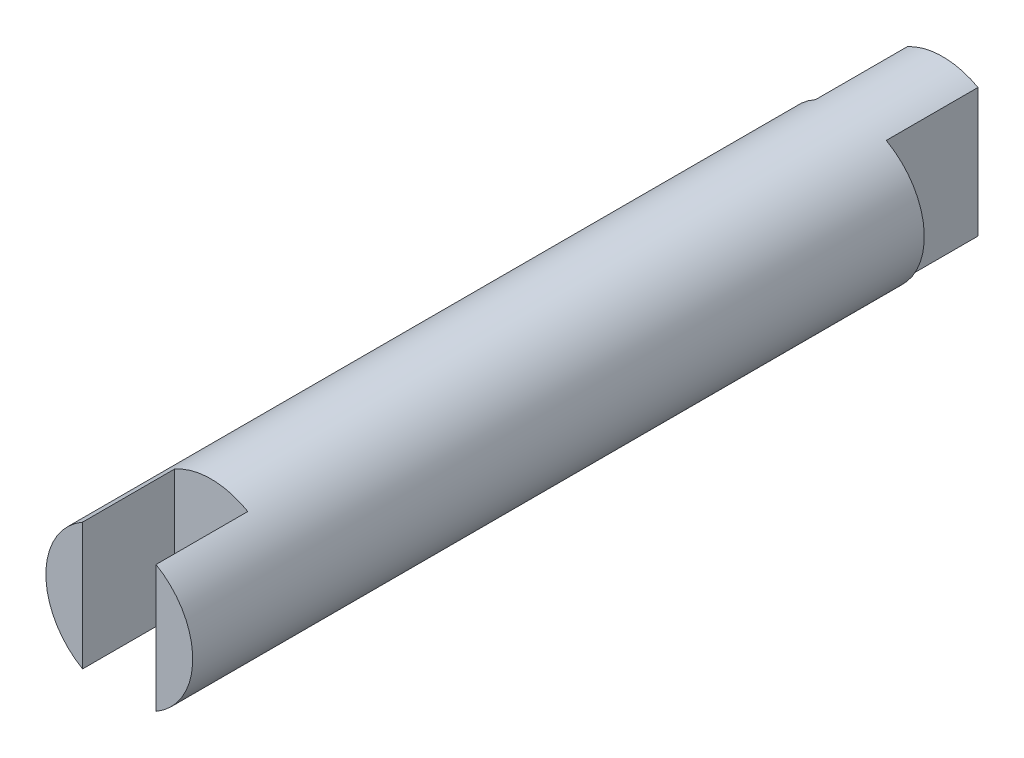
from build123d import *
from build123d.topology import SkipClean

# Parameters (mm, degrees)
SKETCH1_R           = 4
BOSS_EXTRUDE1_DEPTH = 39.85
BOSS_EXTRUDE2_START = 5
BOSS_EXTRUDE2_DEPTH = 5
CUT_EXTRUDE1_START  = -5
CUT_EXTRUDE1_DEPTH  = 5


with BuildPart() as part:
    # Sketch1 → Boss-Extrude1 (new body)
    with BuildSketch(Plane.XY):
        Circle(SKETCH1_R)
    extrude(amount=-BOSS_EXTRUDE1_DEPTH)

    # Sketch2 → Boss-Extrude2 (add)
    with SkipClean():  # the faces are left unmerged after this step: merging them gives an invalid solid
        with BuildSketch(Plane.XY.offset(BOSS_EXTRUDE2_START)):
            with BuildLine():
                Line((-2, 3.464101615), (-2, -3.464101615))
                ThreePointArc((-2, -3.464101615), (-4, 0), (-2, 3.464101615))
            make_face()
            with BuildLine():
                Line((2, 3.464101615), (2, -3.464101615))
                ThreePointArc((2, -3.464101615), (4, 0), (2, 3.464101615))
            make_face()
        extrude(amount=-BOSS_EXTRUDE2_DEPTH)

    # Sketch3 → Cut-Extrude1 (cut)
    with SkipClean():  # the faces are left unmerged after this step: merging them gives an invalid solid
        with BuildSketch(Plane(origin=(0, 0, -39.85), x_dir=(-1, 0, 0), z_dir=(0, 0, -1)).offset(CUT_EXTRUDE1_START)):
            with BuildLine():
                Line((-1.925, 3.506333555), (-1.925, -3.506333555))
                ThreePointArc((-1.925, -3.506333555), (-4, 0), (-1.925, 3.506333555))
            make_face()
            with BuildLine():
                Line((1.925, 3.506333555), (1.925, -3.506333555))
                ThreePointArc((1.925, -3.506333555), (4, 0), (1.925, 3.506333555))
            make_face()
        extrude(amount=CUT_EXTRUDE1_DEPTH, mode=Mode.SUBTRACT)


solid = part.part
